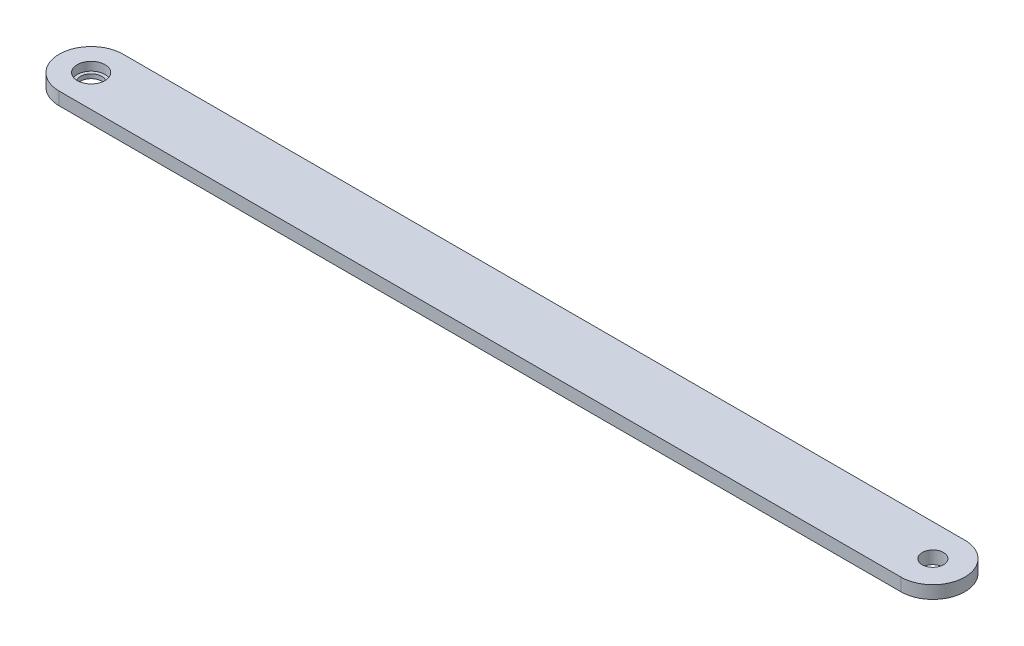
from build123d import *

# Parameters (mm, degrees)
SKETCH2_R           = 5
BOSS_EXTRUDE1_DEPTH = 6
SKETCH4_R           = 6.5
CUT_EXTRUDE2_DEPTH  = 4


with BuildPart() as part:
    # Sketch2 → Boss-Extrude1 (new body)
    with BuildSketch(Plane(origin=(0, 0, 0), x_dir=(1, 0, 0), z_dir=(0, 1, 0))):
        with BuildLine():
            Line((-45, 15), (350, 15))
            ThreePointArc((350, 15), (365, 0), (350, -15))
            Line((350, -15), (-45, -15))
            ThreePointArc((-45, -15), (-60, 0), (-45, 15))
        make_face()
        with Locations(Location((-45, 0, 0), (0, 0, 270))):
            Circle(SKETCH2_R, mode=Mode.SUBTRACT)
        with Locations(Location((350, 0, 0), (0, 0, 270))):
            Circle(SKETCH2_R, mode=Mode.SUBTRACT)
    extrude(amount=BOSS_EXTRUDE1_DEPTH)

    # Sketch4 → Cut-Extrude2 (cut)
    with BuildSketch(Plane(origin=(0, 6, 0), x_dir=(1, 0, 0), z_dir=(0, 1, 0))):
        with Locations(Location((-45, 0, 0), (0, 0, 270))):
            Circle(SKETCH4_R)
    extrude(amount=-CUT_EXTRUDE2_DEPTH, mode=Mode.SUBTRACT)


solid = part.part
